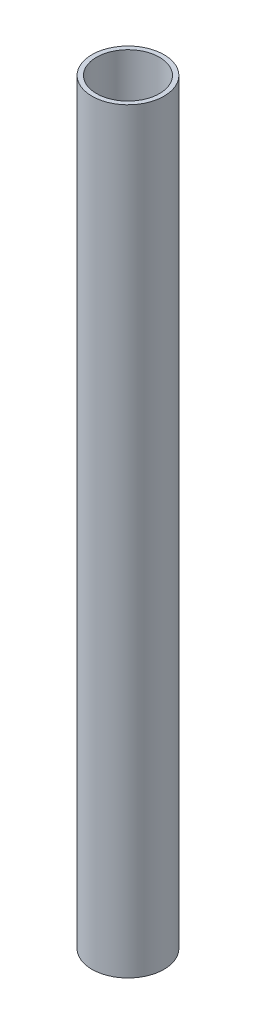
from build123d import *

# Parameters (mm, degrees)
SKETCH1_R           = 50.8
SKETCH1_R_2         = 44.45
BOSS_EXTRUDE1_DEPTH = 1066.8


with BuildPart() as part:
    # Sketch1 → Boss-Extrude1 (new body)
    with BuildSketch(Plane(origin=(0, 0, 0), x_dir=(1, 0, 0), z_dir=(0, 1, 0))):
        with Locations(Location((0, 0, 0), (0, 0, 270))):
            Circle(SKETCH1_R)
        with Locations(Location((0, 0, 0), (0, 0, 270))):
            Circle(SKETCH1_R_2, mode=Mode.SUBTRACT)
    extrude(amount=BOSS_EXTRUDE1_DEPTH)


solid = part.part
